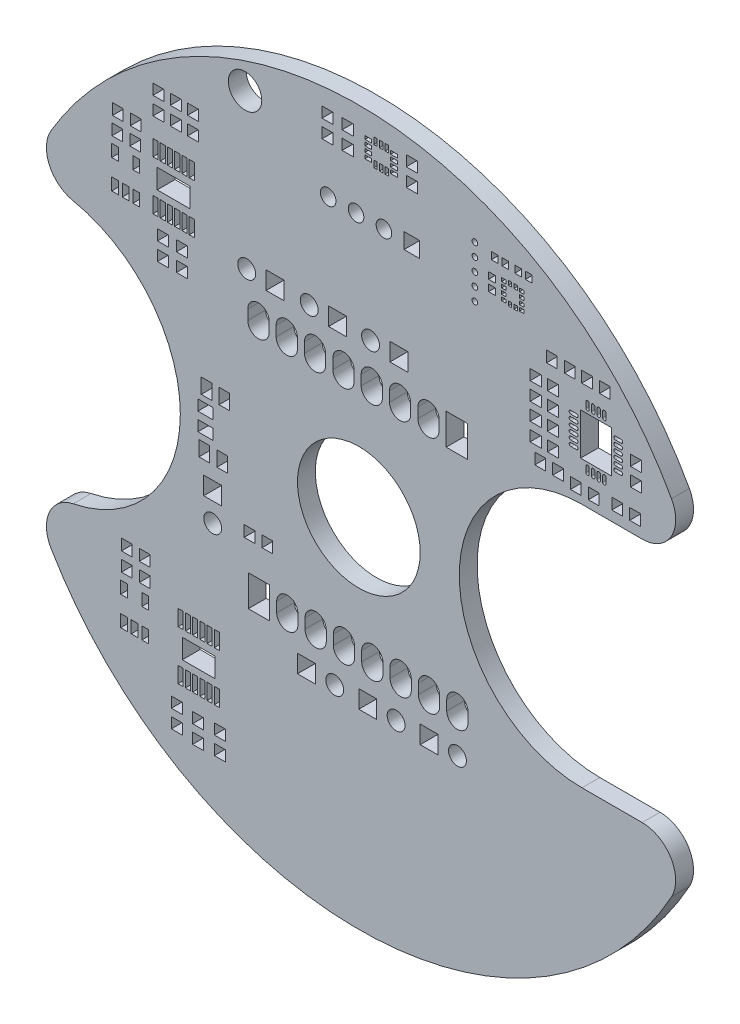
from build123d import *

# Parameters (mm, degrees)
MODEL_R            = 0.254
MODEL_R_2          = 1.5
MODEL_R_3          = 0.7
MODEL_R_4          = 0.8
MODEL_R_5          = 5.5
MODEL_W            = 0.4
MODEL_H            = 0.3
MODEL_W_2          = 0.3
MODEL_H_2          = 0.4
MODEL_W_3          = 0.59
MODEL_H_3          = 0.64
MODEL_W_4          = 0.64
MODEL_H_4          = 0.59
MODEL_W_5          = 0.95
MODEL_H_5          = 1.35
MODEL_W_6          = 1.35
MODEL_H_6          = 0.95
MODEL_W_7          = 0.6
MODEL_H_7          = 1.1
MODEL_W_8          = 0.45
MODEL_H_8          = 1.425
MODEL_W_9          = 2.947
MODEL_H_9          = 1.753
MODEL_W_10         = 1.905
MODEL_H_10         = 2.794
MODEL_H_11         = 0.6
MODEL_W_11         = 2.75
MODEL_H_12         = 3.75
MODEL_H_13         = 1
MODEL_W_12         = 1
MODEL_W_13         = 1.4
MODEL_H_14         = 1.4
MODEL_W_14         = 1.6
MODEL_H_15         = 1.6
BOSS_EXTRU_1_DEPTH = 1.6


with BuildPart() as part:
    # Model → Boss.-Extru.1 (new body)
    with BuildSketch(Plane.XY):
        with BuildLine():
            Line((25.396899903, -10.999993012), (19.999999903, -10.999993012))
            ThreePointArc((19.999999903, -10.999993012), (8.999999903, 6.988e-06), (19.999999903, 11.000006988))
            Line((19.999999903, 11.000006988), (25.396899903, 11.000006988))
            ThreePointArc((25.396899903, 11.000006988), (27.97996517, 12.474395332), (28.024096726, 15.448298418))
            ThreePointArc((28.024096726, 15.448298418), (0.442472559, 31.996936135), (-27.5862, 16.2173))
            ThreePointArc((-27.5862, 16.2173), (-27.740535183, 13.476382519), (-25.6, 11.7575))
            ThreePointArc((-25.6, 11.7575), (-15.999807577, -5e-05), (-25.6, -11.7576))
            ThreePointArc((-25.6, -11.7576), (-27.740471547, -13.476449402), (-27.5862, -16.2173))
            ThreePointArc((-27.5862, -16.2173), (0.442475694, -31.996932561), (28.024099903, -15.448293012))
            ThreePointArc((28.024099903, -15.448293012), (27.979973551, -12.474382167), (25.396899903, -10.999993012))
        make_face()
        with Locations((10.4, 21.95)):
            Circle(MODEL_R, mode=Mode.SUBTRACT)
        with Locations((10.4, 23.1)):
            Circle(MODEL_R, mode=Mode.SUBTRACT)
        with Locations((10.4, 24.25)):
            Circle(MODEL_R, mode=Mode.SUBTRACT)
        with Locations((10.4, 25.4)):
            Circle(MODEL_R, mode=Mode.SUBTRACT)
        with Locations((10.4, 26.55)):
            Circle(MODEL_R, mode=Mode.SUBTRACT)
        with Locations((-10.2, 28)):
            Circle(MODEL_R_2, mode=Mode.SUBTRACT)
        with Locations((2.25, 23.5)):
            Circle(MODEL_R_3, mode=Mode.SUBTRACT)
        with Locations((-0.25, 23.5)):
            Circle(MODEL_R_3, mode=Mode.SUBTRACT)
        with Locations((-2.75, 23.5)):
            Circle(MODEL_R_3, mode=Mode.SUBTRACT)
        with Locations((-10.05, 14.25)):
            Circle(MODEL_R_4, mode=Mode.SUBTRACT)
        with Locations((-4.45, 14.25)):
            Circle(MODEL_R_4, mode=Mode.SUBTRACT)
        with Locations((1.05, 14.25)):
            Circle(MODEL_R_4, mode=Mode.SUBTRACT)
        with Locations((8.84, -14.1)):
            Circle(MODEL_R_4, mode=Mode.SUBTRACT)
        with Locations((3.34, -14.1)):
            Circle(MODEL_R_4, mode=Mode.SUBTRACT)
        with Locations((-2.16, -14.1)):
            Circle(MODEL_R_4, mode=Mode.SUBTRACT)
        with Locations((-13.1, -7.02)):
            Circle(MODEL_R_4, mode=Mode.SUBTRACT)
        with Locations((6.088e-06, 3.579e-06)):
            Circle(MODEL_R_5, mode=Mode.SUBTRACT)
        with Locations((14.6, 23.35)):
            Rectangle(MODEL_W, MODEL_H, mode=Mode.SUBTRACT)
        with Locations((14.6, 23.85)):
            Rectangle(MODEL_W, MODEL_H, mode=Mode.SUBTRACT)
        with Locations((14.6, 24.35)):
            Rectangle(MODEL_W, MODEL_H, mode=Mode.SUBTRACT)
        with Locations((14.6, 24.85)):
            Rectangle(MODEL_W, MODEL_H, mode=Mode.SUBTRACT)
        with Locations((14.05, 24.9)):
            Rectangle(MODEL_W_2, MODEL_H_2, mode=Mode.SUBTRACT)
        with Locations((13.55, 24.9)):
            Rectangle(MODEL_W_2, MODEL_H_2, mode=Mode.SUBTRACT)
        with Locations((13, 24.85)):
            Rectangle(MODEL_W, MODEL_H, mode=Mode.SUBTRACT)
        with Locations((13, 24.35)):
            Rectangle(MODEL_W, MODEL_H, mode=Mode.SUBTRACT)
        with Locations((13, 23.85)):
            Rectangle(MODEL_W, MODEL_H, mode=Mode.SUBTRACT)
        with Locations((13, 23.35)):
            Rectangle(MODEL_W, MODEL_H, mode=Mode.SUBTRACT)
        with Locations((13.55, 23.3)):
            Rectangle(MODEL_W_2, MODEL_H_2, mode=Mode.SUBTRACT)
        with Locations((14.05, 23.3)):
            Rectangle(MODEL_W_2, MODEL_H_2, mode=Mode.SUBTRACT)
        with Locations((14.27, 26.25)):
            Rectangle(MODEL_W_3, MODEL_H_3, mode=Mode.SUBTRACT)
        with Locations((15.23, 26.25)):
            Rectangle(MODEL_W_3, MODEL_H_3, mode=Mode.SUBTRACT)
        with Locations((13.13, 26.25)):
            Rectangle(MODEL_W_3, MODEL_H_3, mode=Mode.SUBTRACT)
        with Locations((12.17, 26.25)):
            Rectangle(MODEL_W_3, MODEL_H_3, mode=Mode.SUBTRACT)
        with Locations((11.95, 24.58)):
            Rectangle(MODEL_W_4, MODEL_H_4, mode=Mode.SUBTRACT)
        with Locations((11.95, 23.62)):
            Rectangle(MODEL_W_4, MODEL_H_4, mode=Mode.SUBTRACT)
        with Locations((-12.25, -1.8)):
            Rectangle(MODEL_W_5, MODEL_H_5, mode=Mode.SUBTRACT)
        with Locations((-13.85, -1.8)):
            Rectangle(MODEL_W_5, MODEL_H_5, mode=Mode.SUBTRACT)
        with Locations((-12.05, 3.15)):
            Rectangle(MODEL_W_5, MODEL_H_5, mode=Mode.SUBTRACT)
        with Locations((-13.65, 3.15)):
            Rectangle(MODEL_W_5, MODEL_H_5, mode=Mode.SUBTRACT)
        with Locations((-13.75, -0.1)):
            Rectangle(MODEL_W_6, MODEL_H_6, mode=Mode.SUBTRACT)
        with Locations((-13.75, 1.5)):
            Rectangle(MODEL_W_6, MODEL_H_6, mode=Mode.SUBTRACT)
        with Locations((-21.85, 14.8)):
            Rectangle(MODEL_W_7, MODEL_H_7, mode=Mode.SUBTRACT)
        with Locations((-20.9, 14.8)):
            Rectangle(MODEL_W_7, MODEL_H_7, mode=Mode.SUBTRACT)
        with Locations((-19.95, 14.8)):
            Rectangle(MODEL_W_7, MODEL_H_7, mode=Mode.SUBTRACT)
        with Locations((-19.95, 17.4)):
            Rectangle(MODEL_W_7, MODEL_H_7, mode=Mode.SUBTRACT)
        with Locations((-21.85, 17.4)):
            Rectangle(MODEL_W_7, MODEL_H_7, mode=Mode.SUBTRACT)
        with Locations((-21.05, -18.7)):
            Rectangle(MODEL_W_7, MODEL_H_7, mode=Mode.SUBTRACT)
        with Locations((-20.1, -18.7)):
            Rectangle(MODEL_W_7, MODEL_H_7, mode=Mode.SUBTRACT)
        with Locations((-19.15, -18.7)):
            Rectangle(MODEL_W_7, MODEL_H_7, mode=Mode.SUBTRACT)
        with Locations((-19.15, -16.1)):
            Rectangle(MODEL_W_7, MODEL_H_7, mode=Mode.SUBTRACT)
        with Locations((-21.05, -16.1)):
            Rectangle(MODEL_W_7, MODEL_H_7, mode=Mode.SUBTRACT)
        with Locations((-18.225, 15.038)):
            Rectangle(MODEL_W_8, MODEL_H_8, mode=Mode.SUBTRACT)
        with Locations((-17.575, 15.038)):
            Rectangle(MODEL_W_8, MODEL_H_8, mode=Mode.SUBTRACT)
        with Locations((-16.925, 15.038)):
            Rectangle(MODEL_W_8, MODEL_H_8, mode=Mode.SUBTRACT)
        with Locations((-16.275, 15.038)):
            Rectangle(MODEL_W_8, MODEL_H_8, mode=Mode.SUBTRACT)
        with Locations((-15.625, 15.038)):
            Rectangle(MODEL_W_8, MODEL_H_8, mode=Mode.SUBTRACT)
        with Locations((-14.975, 15.038)):
            Rectangle(MODEL_W_8, MODEL_H_8, mode=Mode.SUBTRACT)
        with Locations((-14.975, 19.462)):
            Rectangle(MODEL_W_8, MODEL_H_8, mode=Mode.SUBTRACT)
        with Locations((-15.625, 19.462)):
            Rectangle(MODEL_W_8, MODEL_H_8, mode=Mode.SUBTRACT)
        with Locations((-16.275, 19.462)):
            Rectangle(MODEL_W_8, MODEL_H_8, mode=Mode.SUBTRACT)
        with Locations((-16.925, 19.462)):
            Rectangle(MODEL_W_8, MODEL_H_8, mode=Mode.SUBTRACT)
        with Locations((-17.575, 19.462)):
            Rectangle(MODEL_W_8, MODEL_H_8, mode=Mode.SUBTRACT)
        with Locations((-18.225, 19.462)):
            Rectangle(MODEL_W_8, MODEL_H_8, mode=Mode.SUBTRACT)
        with Locations((-16.6, 17.25)):
            Rectangle(MODEL_W_9, MODEL_H_9, mode=Mode.SUBTRACT)
        with Locations((-12.725, -15.888)):
            Rectangle(MODEL_W_8, MODEL_H_8, mode=Mode.SUBTRACT)
        with Locations((-13.375, -15.888)):
            Rectangle(MODEL_W_8, MODEL_H_8, mode=Mode.SUBTRACT)
        with Locations((-14.025, -15.888)):
            Rectangle(MODEL_W_8, MODEL_H_8, mode=Mode.SUBTRACT)
        with Locations((-14.675, -15.888)):
            Rectangle(MODEL_W_8, MODEL_H_8, mode=Mode.SUBTRACT)
        with Locations((-15.325, -15.888)):
            Rectangle(MODEL_W_8, MODEL_H_8, mode=Mode.SUBTRACT)
        with Locations((-15.975, -15.888)):
            Rectangle(MODEL_W_8, MODEL_H_8, mode=Mode.SUBTRACT)
        with Locations((-15.975, -20.312)):
            Rectangle(MODEL_W_8, MODEL_H_8, mode=Mode.SUBTRACT)
        with Locations((-15.325, -20.312)):
            Rectangle(MODEL_W_8, MODEL_H_8, mode=Mode.SUBTRACT)
        with Locations((-14.675, -20.312)):
            Rectangle(MODEL_W_8, MODEL_H_8, mode=Mode.SUBTRACT)
        with Locations((-14.025, -20.312)):
            Rectangle(MODEL_W_8, MODEL_H_8, mode=Mode.SUBTRACT)
        with Locations((-13.375, -20.312)):
            Rectangle(MODEL_W_8, MODEL_H_8, mode=Mode.SUBTRACT)
        with Locations((-12.725, -20.312)):
            Rectangle(MODEL_W_8, MODEL_H_8, mode=Mode.SUBTRACT)
        with Locations((-14.35, -18.1)):
            Rectangle(MODEL_W_9, MODEL_H_9, mode=Mode.SUBTRACT)
        with Locations((8.78, 10.75)):
            Rectangle(MODEL_W_10, MODEL_H_10, mode=Mode.SUBTRACT)
        with BuildLine():
            Line((5.2875, 10.3055), (5.2875, 11.1945))
            ThreePointArc((5.2875, 11.1945), (6.24, 12.147), (7.1925, 11.1945))
            Line((7.1925, 11.1945), (7.1925, 10.3055))
            ThreePointArc((7.1925, 10.3055), (6.24, 9.353), (5.2875, 10.3055))
        make_face(mode=Mode.SUBTRACT)
        with BuildLine():
            Line((2.7475, 10.3055), (2.7475, 11.1945))
            ThreePointArc((2.7475, 11.1945), (3.7, 12.147), (4.6525, 11.1945))
            Line((4.6525, 11.1945), (4.6525, 10.3055))
            ThreePointArc((4.6525, 10.3055), (3.7, 9.353), (2.7475, 10.3055))
        make_face(mode=Mode.SUBTRACT)
        with BuildLine():
            Line((0.2075, 10.3055), (0.2075, 11.1945))
            ThreePointArc((0.2075, 11.1945), (1.16, 12.147), (2.1125, 11.1945))
            Line((2.1125, 11.1945), (2.1125, 10.3055))
            ThreePointArc((2.1125, 10.3055), (1.16, 9.353), (0.2075, 10.3055))
        make_face(mode=Mode.SUBTRACT)
        with BuildLine():
            Line((-2.3325, 10.3055), (-2.3325, 11.1945))
            ThreePointArc((-2.3325, 11.1945), (-1.38, 12.147), (-0.4275, 11.1945))
            Line((-0.4275, 11.1945), (-0.4275, 10.3055))
            ThreePointArc((-0.4275, 10.3055), (-1.38, 9.353), (-2.3325, 10.3055))
        make_face(mode=Mode.SUBTRACT)
        with BuildLine():
            Line((-4.8725, 10.3055), (-4.8725, 11.1945))
            ThreePointArc((-4.8725, 11.1945), (-3.92, 12.147), (-2.9675, 11.1945))
            Line((-2.9675, 11.1945), (-2.9675, 10.3055))
            ThreePointArc((-2.9675, 10.3055), (-3.92, 9.353), (-4.8725, 10.3055))
        make_face(mode=Mode.SUBTRACT)
        with BuildLine():
            Line((-7.4125, 10.3055), (-7.4125, 11.1945))
            ThreePointArc((-7.4125, 11.1945), (-6.46, 12.147), (-5.5075, 11.1945))
            Line((-5.5075, 11.1945), (-5.5075, 10.3055))
            ThreePointArc((-5.5075, 10.3055), (-6.46, 9.353), (-7.4125, 10.3055))
        make_face(mode=Mode.SUBTRACT)
        with BuildLine():
            Line((-9.9525, 10.3055), (-9.9525, 11.1945))
            ThreePointArc((-9.9525, 11.1945), (-9, 12.147), (-8.0475, 11.1945))
            Line((-8.0475, 11.1945), (-8.0475, 10.3055))
            ThreePointArc((-8.0475, 10.3055), (-9, 9.353), (-9.9525, 10.3055))
        make_face(mode=Mode.SUBTRACT)
        with Locations((-8.95, -10.65)):
            Rectangle(MODEL_W_10, MODEL_H_10, mode=Mode.SUBTRACT)
        with BuildLine():
            Line((-5.4575, -10.2055), (-5.4575, -11.0945))
            ThreePointArc((-5.4575, -11.0945), (-6.41, -12.047), (-7.3625, -11.0945))
            Line((-7.3625, -11.0945), (-7.3625, -10.2055))
            ThreePointArc((-7.3625, -10.2055), (-6.41, -9.253), (-5.4575, -10.2055))
        make_face(mode=Mode.SUBTRACT)
        with BuildLine():
            Line((-2.9175, -10.2055), (-2.9175, -11.0945))
            ThreePointArc((-2.9175, -11.0945), (-3.87, -12.047), (-4.8225, -11.0945))
            Line((-4.8225, -11.0945), (-4.8225, -10.2055))
            ThreePointArc((-4.8225, -10.2055), (-3.87, -9.253), (-2.9175, -10.2055))
        make_face(mode=Mode.SUBTRACT)
        with BuildLine():
            Line((-0.3775, -10.2055), (-0.3775, -11.0945))
            ThreePointArc((-0.3775, -11.0945), (-1.33, -12.047), (-2.2825, -11.0945))
            Line((-2.2825, -11.0945), (-2.2825, -10.2055))
            ThreePointArc((-2.2825, -10.2055), (-1.33, -9.253), (-0.3775, -10.2055))
        make_face(mode=Mode.SUBTRACT)
        with BuildLine():
            Line((2.1625, -10.2055), (2.1625, -11.0945))
            ThreePointArc((2.1625, -11.0945), (1.21, -12.047), (0.2575, -11.0945))
            Line((0.2575, -11.0945), (0.2575, -10.2055))
            ThreePointArc((0.2575, -10.2055), (1.21, -9.253), (2.1625, -10.2055))
        make_face(mode=Mode.SUBTRACT)
        with BuildLine():
            Line((4.7025, -10.2055), (4.7025, -11.0945))
            ThreePointArc((4.7025, -11.0945), (3.75, -12.047), (2.7975, -11.0945))
            Line((2.7975, -11.0945), (2.7975, -10.2055))
            ThreePointArc((2.7975, -10.2055), (3.75, -9.253), (4.7025, -10.2055))
        make_face(mode=Mode.SUBTRACT)
        with BuildLine():
            Line((7.2425, -10.2055), (7.2425, -11.0945))
            ThreePointArc((7.2425, -11.0945), (6.29, -12.047), (5.3375, -11.0945))
            Line((5.3375, -11.0945), (5.3375, -10.2055))
            ThreePointArc((5.3375, -10.2055), (6.29, -9.253), (7.2425, -10.2055))
        make_face(mode=Mode.SUBTRACT)
        with BuildLine():
            Line((9.7825, -10.2055), (9.7825, -11.0945))
            ThreePointArc((9.7825, -11.0945), (8.83, -12.047), (7.8775, -11.0945))
            Line((7.8775, -11.0945), (7.8775, -10.2055))
            ThreePointArc((7.8775, -10.2055), (8.83, -9.253), (9.7825, -10.2055))
        make_face(mode=Mode.SUBTRACT)
        with Locations((3.15, 28.25)):
            Rectangle(MODEL_W_7, MODEL_H, mode=Mode.SUBTRACT)
        with Locations((3.15, 28.75)):
            Rectangle(MODEL_W_7, MODEL_H, mode=Mode.SUBTRACT)
        with Locations((3.15, 29.25)):
            Rectangle(MODEL_W_7, MODEL_H, mode=Mode.SUBTRACT)
        with Locations((3.15, 29.75)):
            Rectangle(MODEL_W_7, MODEL_H, mode=Mode.SUBTRACT)
        with Locations((2.5, 29.9)):
            Rectangle(MODEL_W_2, MODEL_H_11, mode=Mode.SUBTRACT)
        with Locations((2, 29.9)):
            Rectangle(MODEL_W_2, MODEL_H_11, mode=Mode.SUBTRACT)
        with Locations((1.5, 29.9)):
            Rectangle(MODEL_W_2, MODEL_H_11, mode=Mode.SUBTRACT)
        with Locations((0.85, 29.75)):
            Rectangle(MODEL_W_7, MODEL_H, mode=Mode.SUBTRACT)
        with Locations((0.85, 29.25)):
            Rectangle(MODEL_W_7, MODEL_H, mode=Mode.SUBTRACT)
        with Locations((0.85, 28.75)):
            Rectangle(MODEL_W_7, MODEL_H, mode=Mode.SUBTRACT)
        with Locations((0.85, 28.25)):
            Rectangle(MODEL_W_7, MODEL_H, mode=Mode.SUBTRACT)
        with Locations((1.5, 28.1)):
            Rectangle(MODEL_W_2, MODEL_H_11, mode=Mode.SUBTRACT)
        with Locations((2, 28.1)):
            Rectangle(MODEL_W_2, MODEL_H_11, mode=Mode.SUBTRACT)
        with Locations((2.5, 28.1)):
            Rectangle(MODEL_W_2, MODEL_H_11, mode=Mode.SUBTRACT)
        with BuildLine():
            Line((23, 15.3), (23.5, 15.3))
            ThreePointArc((23.5, 15.3), (23.65, 15.15), (23.5, 15))
            Line((23.5, 15), (23, 15))
            ThreePointArc((23, 15), (22.85, 15.15), (23, 15.3))
        make_face(mode=Mode.SUBTRACT)
        with BuildLine():
            Line((23, 15.8), (23.5, 15.8))
            ThreePointArc((23.5, 15.8), (23.65, 15.65), (23.5, 15.5))
            Line((23.5, 15.5), (23, 15.5))
            ThreePointArc((23, 15.5), (22.85, 15.65), (23, 15.8))
        make_face(mode=Mode.SUBTRACT)
        with BuildLine():
            Line((23, 16.3), (23.5, 16.3))
            ThreePointArc((23.5, 16.3), (23.65, 16.15), (23.5, 16))
            Line((23.5, 16), (23, 16))
            ThreePointArc((23, 16), (22.85, 16.15), (23, 16.3))
        make_face(mode=Mode.SUBTRACT)
        with BuildLine():
            Line((23, 16.8), (23.5, 16.8))
            ThreePointArc((23.5, 16.8), (23.65, 16.65), (23.5, 16.5))
            Line((23.5, 16.5), (23, 16.5))
            ThreePointArc((23, 16.5), (22.85, 16.65), (23, 16.8))
        make_face(mode=Mode.SUBTRACT)
        with BuildLine():
            Line((23, 17.3), (23.5, 17.3))
            ThreePointArc((23.5, 17.3), (23.65, 17.15), (23.5, 17))
            Line((23.5, 17), (23, 17))
            ThreePointArc((23, 17), (22.85, 17.15), (23, 17.3))
        make_face(mode=Mode.SUBTRACT)
        with BuildLine():
            Line((23, 17.8), (23.5, 17.8))
            ThreePointArc((23.5, 17.8), (23.65, 17.65), (23.5, 17.5))
            Line((23.5, 17.5), (23, 17.5))
            ThreePointArc((23, 17.5), (22.85, 17.65), (23, 17.8))
        make_face(mode=Mode.SUBTRACT)
        with BuildLine():
            Line((21.85, 18.65), (21.85, 19.15))
            ThreePointArc((21.85, 19.15), (22, 19.3), (22.15, 19.15))
            Line((22.15, 19.15), (22.15, 18.65))
            ThreePointArc((22.15, 18.65), (22, 18.5), (21.85, 18.65))
        make_face(mode=Mode.SUBTRACT)
        with BuildLine():
            Line((21.35, 18.65), (21.35, 19.15))
            ThreePointArc((21.35, 19.15), (21.5, 19.3), (21.65, 19.15))
            Line((21.65, 19.15), (21.65, 18.65))
            ThreePointArc((21.65, 18.65), (21.5, 18.5), (21.35, 18.65))
        make_face(mode=Mode.SUBTRACT)
        with BuildLine():
            Line((20.85, 18.65), (20.85, 19.15))
            ThreePointArc((20.85, 19.15), (21, 19.3), (21.15, 19.15))
            Line((21.15, 19.15), (21.15, 18.65))
            ThreePointArc((21.15, 18.65), (21, 18.5), (20.85, 18.65))
        make_face(mode=Mode.SUBTRACT)
        with BuildLine():
            Line((20.35, 18.65), (20.35, 19.15))
            ThreePointArc((20.35, 19.15), (20.5, 19.3), (20.65, 19.15))
            Line((20.65, 19.15), (20.65, 18.65))
            ThreePointArc((20.65, 18.65), (20.5, 18.5), (20.35, 18.65))
        make_face(mode=Mode.SUBTRACT)
        with BuildLine():
            Line((19, 17.8), (19.5, 17.8))
            ThreePointArc((19.5, 17.8), (19.65, 17.65), (19.5, 17.5))
            Line((19.5, 17.5), (19, 17.5))
            ThreePointArc((19, 17.5), (18.85, 17.65), (19, 17.8))
        make_face(mode=Mode.SUBTRACT)
        with BuildLine():
            Line((19, 17.3), (19.5, 17.3))
            ThreePointArc((19.5, 17.3), (19.65, 17.15), (19.5, 17))
            Line((19.5, 17), (19, 17))
            ThreePointArc((19, 17), (18.85, 17.15), (19, 17.3))
        make_face(mode=Mode.SUBTRACT)
        with BuildLine():
            Line((19, 16.8), (19.5, 16.8))
            ThreePointArc((19.5, 16.8), (19.65, 16.65), (19.5, 16.5))
            Line((19.5, 16.5), (19, 16.5))
            ThreePointArc((19, 16.5), (18.85, 16.65), (19, 16.8))
        make_face(mode=Mode.SUBTRACT)
        with BuildLine():
            Line((19, 16.3), (19.5, 16.3))
            ThreePointArc((19.5, 16.3), (19.65, 16.15), (19.5, 16))
            Line((19.5, 16), (19, 16))
            ThreePointArc((19, 16), (18.85, 16.15), (19, 16.3))
        make_face(mode=Mode.SUBTRACT)
        with BuildLine():
            Line((19, 15.8), (19.5, 15.8))
            ThreePointArc((19.5, 15.8), (19.65, 15.65), (19.5, 15.5))
            Line((19.5, 15.5), (19, 15.5))
            ThreePointArc((19, 15.5), (18.85, 15.65), (19, 15.8))
        make_face(mode=Mode.SUBTRACT)
        with BuildLine():
            Line((19, 15.3), (19.5, 15.3))
            ThreePointArc((19.5, 15.3), (19.65, 15.15), (19.5, 15))
            Line((19.5, 15), (19, 15))
            ThreePointArc((19, 15), (18.85, 15.15), (19, 15.3))
        make_face(mode=Mode.SUBTRACT)
        with BuildLine():
            Line((20.35, 13.65), (20.35, 14.15))
            ThreePointArc((20.35, 14.15), (20.5, 14.3), (20.65, 14.15))
            Line((20.65, 14.15), (20.65, 13.65))
            ThreePointArc((20.65, 13.65), (20.5, 13.5), (20.35, 13.65))
        make_face(mode=Mode.SUBTRACT)
        with BuildLine():
            Line((20.85, 13.65), (20.85, 14.15))
            ThreePointArc((20.85, 14.15), (21, 14.3), (21.15, 14.15))
            Line((21.15, 14.15), (21.15, 13.65))
            ThreePointArc((21.15, 13.65), (21, 13.5), (20.85, 13.65))
        make_face(mode=Mode.SUBTRACT)
        with BuildLine():
            Line((21.35, 13.65), (21.35, 14.15))
            ThreePointArc((21.35, 14.15), (21.5, 14.3), (21.65, 14.15))
            Line((21.65, 14.15), (21.65, 13.65))
            ThreePointArc((21.65, 13.65), (21.5, 13.5), (21.35, 13.65))
        make_face(mode=Mode.SUBTRACT)
        with BuildLine():
            Line((21.85, 13.65), (21.85, 14.15))
            ThreePointArc((21.85, 14.15), (22, 14.3), (22.15, 14.15))
            Line((22.15, 14.15), (22.15, 13.65))
            ThreePointArc((22.15, 13.65), (22, 13.5), (21.85, 13.65))
        make_face(mode=Mode.SUBTRACT)
        with Locations((21.25, 16.4)):
            Rectangle(MODEL_W_11, MODEL_H_12, mode=Mode.SUBTRACT)
        with Locations((-9.8, -6.2)):
            Rectangle(MODEL_W_5, MODEL_H_13, mode=Mode.SUBTRACT)
        with Locations((-8.2, -6.2)):
            Rectangle(MODEL_W_5, MODEL_H_13, mode=Mode.SUBTRACT)
        with Locations((-21.6, 20.65)):
            Rectangle(MODEL_W_5, MODEL_H_13, mode=Mode.SUBTRACT)
        with Locations((-20, 20.65)):
            Rectangle(MODEL_W_5, MODEL_H_13, mode=Mode.SUBTRACT)
        with Locations((-20.8, -12.75)):
            Rectangle(MODEL_W_5, MODEL_H_13, mode=Mode.SUBTRACT)
        with Locations((-19.2, -12.75)):
            Rectangle(MODEL_W_5, MODEL_H_13, mode=Mode.SUBTRACT)
        with Locations((-21.65, 19.05)):
            Rectangle(MODEL_W_5, MODEL_H_13, mode=Mode.SUBTRACT)
        with Locations((-20.05, 19.05)):
            Rectangle(MODEL_W_5, MODEL_H_13, mode=Mode.SUBTRACT)
        with Locations((-20.8, -14.4)):
            Rectangle(MODEL_W_5, MODEL_H_13, mode=Mode.SUBTRACT)
        with Locations((-19.2, -14.4)):
            Rectangle(MODEL_W_5, MODEL_H_13, mode=Mode.SUBTRACT)
        with Locations((-17.95, 24)):
            Rectangle(MODEL_W_12, MODEL_H_6, mode=Mode.SUBTRACT)
        with Locations((-17.95, 22.4)):
            Rectangle(MODEL_W_12, MODEL_H_6, mode=Mode.SUBTRACT)
        with Locations((20.45, 20.9)):
            Rectangle(MODEL_W_5, MODEL_H_13, mode=Mode.SUBTRACT)
        with Locations((22.05, 20.9)):
            Rectangle(MODEL_W_5, MODEL_H_13, mode=Mode.SUBTRACT)
        with Locations((-16.4, 22.4)):
            Rectangle(MODEL_W_12, MODEL_H_6, mode=Mode.SUBTRACT)
        with Locations((-16.4, 24)):
            Rectangle(MODEL_W_12, MODEL_H_6, mode=Mode.SUBTRACT)
        with Locations((-14.4, -23)):
            Rectangle(MODEL_W_12, MODEL_H_6, mode=Mode.SUBTRACT)
        with Locations((-14.4, -24.6)):
            Rectangle(MODEL_W_12, MODEL_H_6, mode=Mode.SUBTRACT)
        with Locations((-17.55, 12.9)):
            Rectangle(MODEL_W_12, MODEL_H_6, mode=Mode.SUBTRACT)
        with Locations((-17.55, 11.3)):
            Rectangle(MODEL_W_12, MODEL_H_6, mode=Mode.SUBTRACT)
        with Locations((-15.85, 11.3)):
            Rectangle(MODEL_W_12, MODEL_H_6, mode=Mode.SUBTRACT)
        with Locations((-15.85, 12.9)):
            Rectangle(MODEL_W_12, MODEL_H_6, mode=Mode.SUBTRACT)
        with Locations((-14.85, 24)):
            Rectangle(MODEL_W_12, MODEL_H_6, mode=Mode.SUBTRACT)
        with Locations((-14.85, 22.4)):
            Rectangle(MODEL_W_12, MODEL_H_6, mode=Mode.SUBTRACT)
        with Locations((4.75, 29.8)):
            Rectangle(MODEL_W_12, MODEL_H_6, mode=Mode.SUBTRACT)
        with Locations((4.75, 28.2)):
            Rectangle(MODEL_W_12, MODEL_H_6, mode=Mode.SUBTRACT)
        with Locations((-2.8, 28.2)):
            Rectangle(MODEL_W_12, MODEL_H_6, mode=Mode.SUBTRACT)
        with Locations((-2.8, 29.8)):
            Rectangle(MODEL_W_12, MODEL_H_6, mode=Mode.SUBTRACT)
        with Locations((-1, 28.2)):
            Rectangle(MODEL_W_12, MODEL_H_6, mode=Mode.SUBTRACT)
        with Locations((-1, 29.8)):
            Rectangle(MODEL_W_12, MODEL_H_6, mode=Mode.SUBTRACT)
        with Locations((16.25, 12.45)):
            Rectangle(MODEL_W_5, MODEL_H_13, mode=Mode.SUBTRACT)
        with Locations((17.85, 12.45)):
            Rectangle(MODEL_W_5, MODEL_H_13, mode=Mode.SUBTRACT)
        with Locations((19.45, 12.15)):
            Rectangle(MODEL_W_5, MODEL_H_13, mode=Mode.SUBTRACT)
        with Locations((21.05, 12.15)):
            Rectangle(MODEL_W_5, MODEL_H_13, mode=Mode.SUBTRACT)
        with Locations((17.3, 20.9)):
            Rectangle(MODEL_W_5, MODEL_H_13, mode=Mode.SUBTRACT)
        with Locations((18.9, 20.9)):
            Rectangle(MODEL_W_5, MODEL_H_13, mode=Mode.SUBTRACT)
        with Locations((24.85, 15)):
            Rectangle(MODEL_W_12, MODEL_H_6, mode=Mode.SUBTRACT)
        with Locations((24.85, 16.6)):
            Rectangle(MODEL_W_12, MODEL_H_6, mode=Mode.SUBTRACT)
        with Locations((24.75, 12.4)):
            Rectangle(MODEL_W_5, MODEL_H_13, mode=Mode.SUBTRACT)
        with Locations((23.15, 12.4)):
            Rectangle(MODEL_W_5, MODEL_H_13, mode=Mode.SUBTRACT)
        with Locations((15.85, 14)):
            Rectangle(MODEL_W_12, MODEL_H_6, mode=Mode.SUBTRACT)
        with Locations((15.85, 15.6)):
            Rectangle(MODEL_W_12, MODEL_H_6, mode=Mode.SUBTRACT)
        with Locations((17.4, 14)):
            Rectangle(MODEL_W_12, MODEL_H_6, mode=Mode.SUBTRACT)
        with Locations((17.4, 15.6)):
            Rectangle(MODEL_W_12, MODEL_H_6, mode=Mode.SUBTRACT)
        with Locations((15.85, 17.15)):
            Rectangle(MODEL_W_12, MODEL_H_6, mode=Mode.SUBTRACT)
        with Locations((15.85, 18.75)):
            Rectangle(MODEL_W_12, MODEL_H_6, mode=Mode.SUBTRACT)
        with Locations((17.4, 17.15)):
            Rectangle(MODEL_W_12, MODEL_H_6, mode=Mode.SUBTRACT)
        with Locations((17.4, 18.75)):
            Rectangle(MODEL_W_12, MODEL_H_6, mode=Mode.SUBTRACT)
        with Locations((-16.3, -22.75)):
            Rectangle(MODEL_W_12, MODEL_H_6, mode=Mode.SUBTRACT)
        with Locations((-16.3, -24.35)):
            Rectangle(MODEL_W_12, MODEL_H_6, mode=Mode.SUBTRACT)
        with Locations((-12.45, -24.5)):
            Rectangle(MODEL_W_12, MODEL_H_6, mode=Mode.SUBTRACT)
        with Locations((-12.45, -22.9)):
            Rectangle(MODEL_W_12, MODEL_H_6, mode=Mode.SUBTRACT)
        with Locations((4.75, 23.5)):
            Rectangle(MODEL_W_13, MODEL_H_14, mode=Mode.SUBTRACT)
        with Locations((-7.51, 14.25)):
            Rectangle(MODEL_W_14, MODEL_H_15, mode=Mode.SUBTRACT)
        with Locations((-1.91, 14.25)):
            Rectangle(MODEL_W_14, MODEL_H_15, mode=Mode.SUBTRACT)
        with Locations((3.59, 14.25)):
            Rectangle(MODEL_W_14, MODEL_H_15, mode=Mode.SUBTRACT)
        with Locations((6.3, -14.1)):
            Rectangle(MODEL_W_14, MODEL_H_15, mode=Mode.SUBTRACT)
        with Locations((0.8, -14.1)):
            Rectangle(MODEL_W_14, MODEL_H_15, mode=Mode.SUBTRACT)
        with Locations((-4.7, -14.1)):
            Rectangle(MODEL_W_14, MODEL_H_15, mode=Mode.SUBTRACT)
        with Locations((-13.1, -4.48)):
            Rectangle(MODEL_W_14, MODEL_H_15, mode=Mode.SUBTRACT)
    extrude(amount=BOSS_EXTRU_1_DEPTH)


solid = part.part
